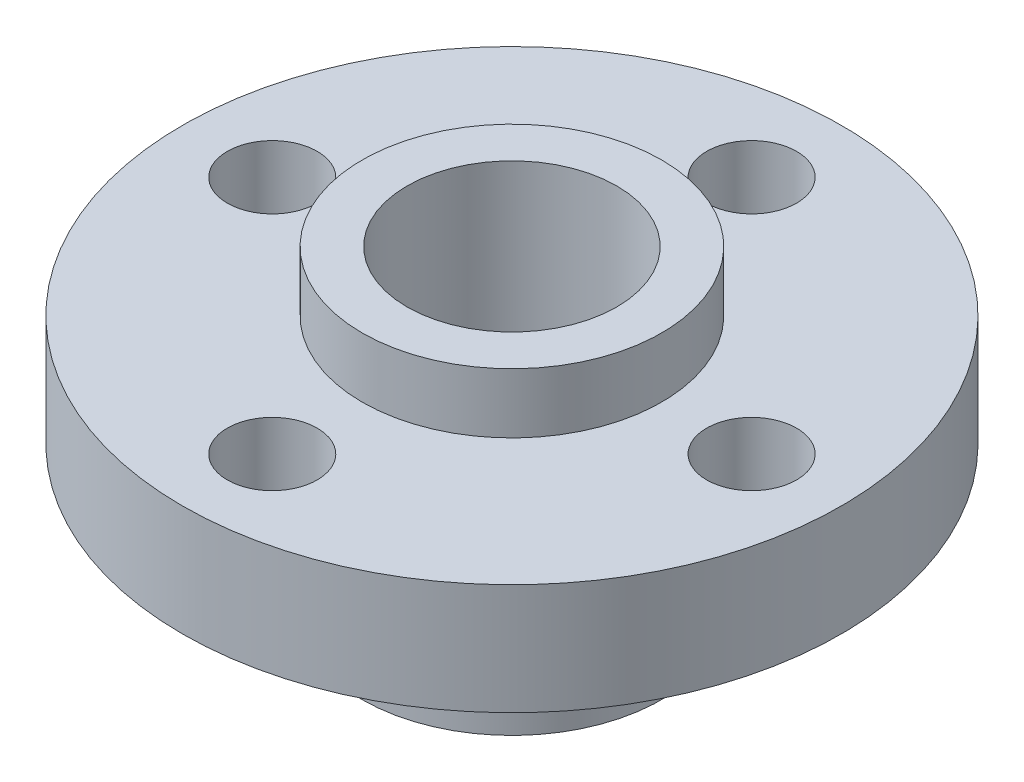
from build123d import *

# Parameters (mm, degrees)
SKETCH1_R           = 11
BOSS_EXTRUDE1_DEPTH = 3.7
CUT_EXTRUDE1_REACH  = 17.99
SKETCH2_R           = 1.5
BOSS_EXTRUDE2_START = 2
SKETCH3_R           = 5
BOSS_EXTRUDE2_DEPTH = 10.6
CUT_EXTRUDE2_REACH  = 20.824
SKETCH4_R           = 3.5


with BuildPart() as part:
    # Sketch1 → Boss-Extrude1 (new body)
    with BuildSketch(Plane(origin=(0, 0, 0), x_dir=(1, 0, 0), z_dir=(0, 1, 0))):
        with Locations(Location((0, 0, 0), (0, 0, 270))):
            Circle(SKETCH1_R)
    extrude(amount=BOSS_EXTRUDE1_DEPTH)

    # Sketch2 → Cut-Extrude1 (cut, up to next)
    with BuildSketch(Plane(origin=(0, 3.7, 0), x_dir=(1, 0, 0), z_dir=(0, 1, 0)), mode=Mode.PRIVATE) as cut_extrude1_sk1:
        with Locations(Location((0, 8, 0), (0, 0, 270))):
            Circle(SKETCH2_R)
    cut_extrude1_tool1 = extrude(cut_extrude1_sk1.sketch, amount=-CUT_EXTRUDE1_REACH, mode=Mode.PRIVATE) & part.part
    # Sketch2 → Cut-Extrude1 (cut, up to next)
    with BuildSketch(Plane(origin=(0, 3.7, 0), x_dir=(1, 0, 0), z_dir=(0, 1, 0)), mode=Mode.PRIVATE) as cut_extrude1_sk2:
        with Locations(Location((8, 0, 0), (0, 0, 270))):
            Circle(SKETCH2_R)
    cut_extrude1_tool2 = extrude(cut_extrude1_sk2.sketch, amount=-CUT_EXTRUDE1_REACH, mode=Mode.PRIVATE) & part.part
    # Sketch2 → Cut-Extrude1 (cut, up to next)
    with BuildSketch(Plane(origin=(0, 3.7, 0), x_dir=(1, 0, 0), z_dir=(0, 1, 0)), mode=Mode.PRIVATE) as cut_extrude1_sk3:
        with Locations(Location((0, -8, 0), (0, 0, 270))):
            Circle(SKETCH2_R)
    cut_extrude1_tool3 = extrude(cut_extrude1_sk3.sketch, amount=-CUT_EXTRUDE1_REACH, mode=Mode.PRIVATE) & part.part
    # Sketch2 → Cut-Extrude1 (cut, up to next)
    with BuildSketch(Plane(origin=(0, 3.7, 0), x_dir=(1, 0, 0), z_dir=(0, 1, 0)), mode=Mode.PRIVATE) as cut_extrude1_sk4:
        with Locations(Location((-8, 0, 0), (0, 0, 270))):
            Circle(SKETCH2_R)
    cut_extrude1_tool4 = extrude(cut_extrude1_sk4.sketch, amount=-CUT_EXTRUDE1_REACH, mode=Mode.PRIVATE) & part.part
    add(cut_extrude1_tool1.solids().sort_by_distance((0, 3.7, -8))[0], mode=Mode.SUBTRACT)
    add(cut_extrude1_tool2.solids().sort_by_distance((8, 3.7, 0))[0], mode=Mode.SUBTRACT)
    add(cut_extrude1_tool3.solids().sort_by_distance((0, 3.7, 8))[0], mode=Mode.SUBTRACT)
    add(cut_extrude1_tool4.solids().sort_by_distance((-8, 3.7, 0))[0], mode=Mode.SUBTRACT)

    # Sketch3 → Boss-Extrude2 (add)
    with BuildSketch(Plane(origin=(0, 3.7, 0), x_dir=(1, 0, 0), z_dir=(0, 1, 0)).offset(BOSS_EXTRUDE2_START)):
        with Locations(Location((0, 0, 0), (0, 0, 270))):
            Circle(SKETCH3_R)
    extrude(amount=-BOSS_EXTRUDE2_DEPTH)

    # Sketch4 → Cut-Extrude2 (cut, up to next)
    with BuildSketch(Plane(origin=(0, 5.7, 0), x_dir=(1, 0, 0), z_dir=(0, 1, 0)), mode=Mode.PRIVATE) as cut_extrude2_sk1:
        with Locations(Location((0, 0, 0), (0, 0, 270))):
            Circle(SKETCH4_R)
    cut_extrude2_tool1 = extrude(cut_extrude2_sk1.sketch, amount=-CUT_EXTRUDE2_REACH, mode=Mode.PRIVATE) & part.part
    add(cut_extrude2_tool1.solids().sort_by_distance((0, 5.7, 0))[0], mode=Mode.SUBTRACT)


solid = part.part
